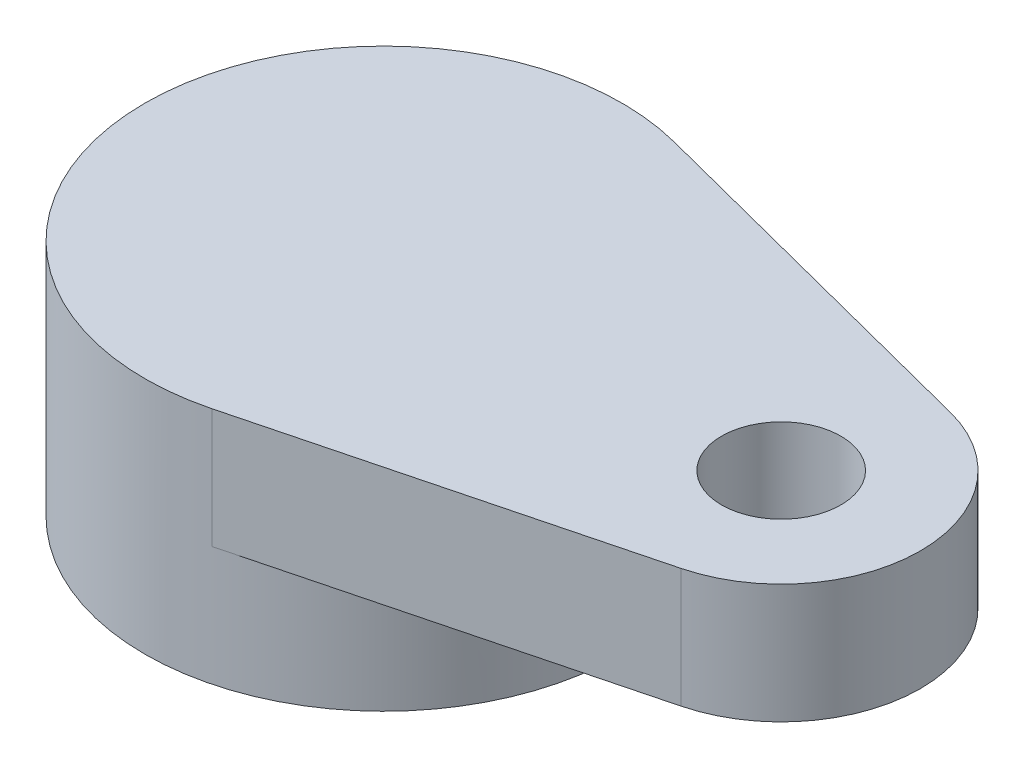
from build123d import *

# Parameters (mm, degrees)
CROQUIS1_R              = 3
SALIENTE_EXTRUIR1_DEPTH = 3
SALIENTE_EXTRUIR2_START = -1.5
CROQUIS2_R              = 0.75
SALIENTE_EXTRUIR2_DEPTH = 1.5
CROQUIS3_R              = 2.4
CORTAR_EXTRUIR1_DEPTH   = 2


with BuildPart() as part:
    # Croquis1 → Saliente-Extruir1 (new body)
    with BuildSketch(Plane(origin=(0, 0, 0), x_dir=(1, 0, 0), z_dir=(0, 1, 0))):
        with Locations(Location((0, 0, 0), (0, 0, 270))):
            Circle(CROQUIS1_R)
    extrude(amount=SALIENTE_EXTRUIR1_DEPTH)

    # Croquis2 → Saliente-Extruir2 (add)
    with BuildSketch(Plane(origin=(0, 3, 0), x_dir=(1, 0, 0), z_dir=(0, 1, 0)).offset(SALIENTE_EXTRUIR2_START)):
        with BuildLine():
            Line((5.4375, 1.694430214), (0.75, 2.90473751))
            ThreePointArc((0.75, 2.90473751), (2.371708245, 1.837117307), (3, 0))
            ThreePointArc((3, 0), (2.371708245, -1.837117307), (0.75, -2.90473751))
            Line((0.75, -2.90473751), (5.4375, -1.694430214))
            ThreePointArc((5.4375, -1.694430214), (6.75, 0), (5.4375, 1.694430214))
        make_face()
        with Locations(Location((5, 0, 0), (0, 0, 270))):
            Circle(CROQUIS2_R, mode=Mode.SUBTRACT)
    extrude(amount=SALIENTE_EXTRUIR2_DEPTH)

    # Croquis3 → Cortar-Extruir1 (cut)
    with BuildSketch(Plane.XZ):
        with Locations(Location((0, 0, 0), (0, 0, 270))):
            Circle(CROQUIS3_R)
    extrude(amount=-CORTAR_EXTRUIR1_DEPTH, mode=Mode.SUBTRACT)


solid = part.part
